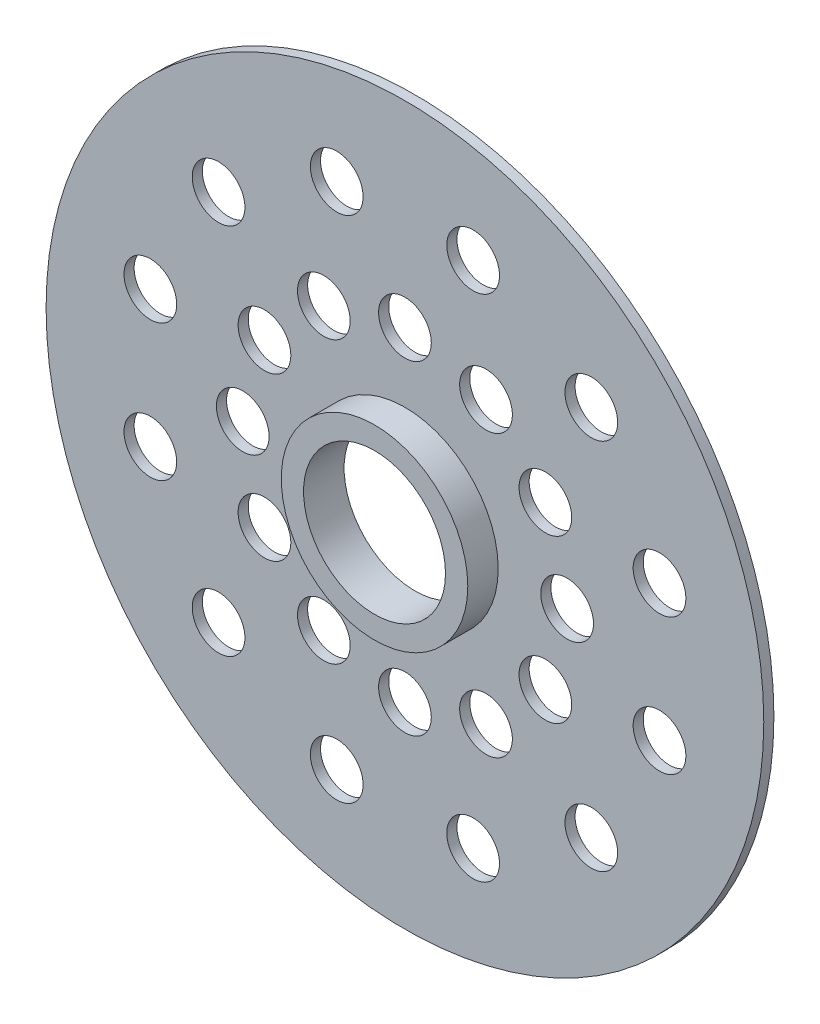
from build123d import *

# Parameters (mm, degrees)
REAR_COVER_REFERENCE_START   = -42
SKETCH_1_R                   = 88.5
SKETCH_1_R_2                 = 17.5
REAR_COVER_REFERENCE_DEPTH   = 2.5
BEARING_BOSS_REFERENCE_START = -42
SKETCH_2_R                   = 23
SKETCH_2_R_2                 = 17.5
BEARING_BOSS_REFERENCE_DEPTH = 10
SKETCH_3_R                   = 6.5
THROUGH_HOLES_DEPTH          = 100


with BuildPart() as part:
    # Эскиз1 → Rear_cover_reference (new body)
    with BuildSketch(Plane.XY.offset(REAR_COVER_REFERENCE_START)):
        Circle(SKETCH_1_R)
        Circle(SKETCH_1_R_2, mode=Mode.SUBTRACT)
    extrude(amount=REAR_COVER_REFERENCE_DEPTH)

    # Эскиз2 → Bearing_boss_reference (add)
    with BuildSketch(Plane.XY.offset(BEARING_BOSS_REFERENCE_START)):
        Circle(SKETCH_2_R)
        Circle(SKETCH_2_R_2, mode=Mode.SUBTRACT)
    extrude(amount=BEARING_BOSS_REFERENCE_DEPTH)

    # Эскиз3 → Through_holes (cut, symmetric)
    with BuildSketch(Plane.XY):
        with Locations((40, 0)):
            Circle(SKETCH_3_R)
        with Locations((34.641016151, 20)):
            Circle(SKETCH_3_R)
        with Locations((20, 34.641016151)):
            Circle(SKETCH_3_R)
        with Locations((0, 40)):
            Circle(SKETCH_3_R)
        with Locations((-20, 34.641016151)):
            Circle(SKETCH_3_R)
        with Locations((-34.641016151, 20)):
            Circle(SKETCH_3_R)
        with Locations((-40, 0)):
            Circle(SKETCH_3_R)
        with Locations((-34.641016151, -20)):
            Circle(SKETCH_3_R)
        with Locations((-20, -34.641016151)):
            Circle(SKETCH_3_R)
        with Locations((0, -40)):
            Circle(SKETCH_3_R)
        with Locations((20, -34.641016151)):
            Circle(SKETCH_3_R)
        with Locations((34.641016151, -20)):
            Circle(SKETCH_3_R)
        with Locations((62.785178709, 16.823237932)):
            Circle(SKETCH_3_R)
        with Locations((45.961940777, 45.961940777)):
            Circle(SKETCH_3_R)
        with Locations((16.823237932, 62.785178709)):
            Circle(SKETCH_3_R)
        with Locations((-16.823237932, 62.785178709)):
            Circle(SKETCH_3_R)
        with Locations((-45.961940777, 45.961940777)):
            Circle(SKETCH_3_R)
        with Locations((-62.785178709, 16.823237932)):
            Circle(SKETCH_3_R)
        with Locations((-62.785178709, -16.823237932)):
            Circle(SKETCH_3_R)
        with Locations((-45.961940777, -45.961940777)):
            Circle(SKETCH_3_R)
        with Locations((-16.823237932, -62.785178709)):
            Circle(SKETCH_3_R)
        with Locations((16.823237932, -62.785178709)):
            Circle(SKETCH_3_R)
        with Locations((45.961940777, -45.961940777)):
            Circle(SKETCH_3_R)
        with Locations((62.785178709, -16.823237932)):
            Circle(SKETCH_3_R)
    extrude(amount=THROUGH_HOLES_DEPTH, both=True, mode=Mode.SUBTRACT)


solid = part.part
